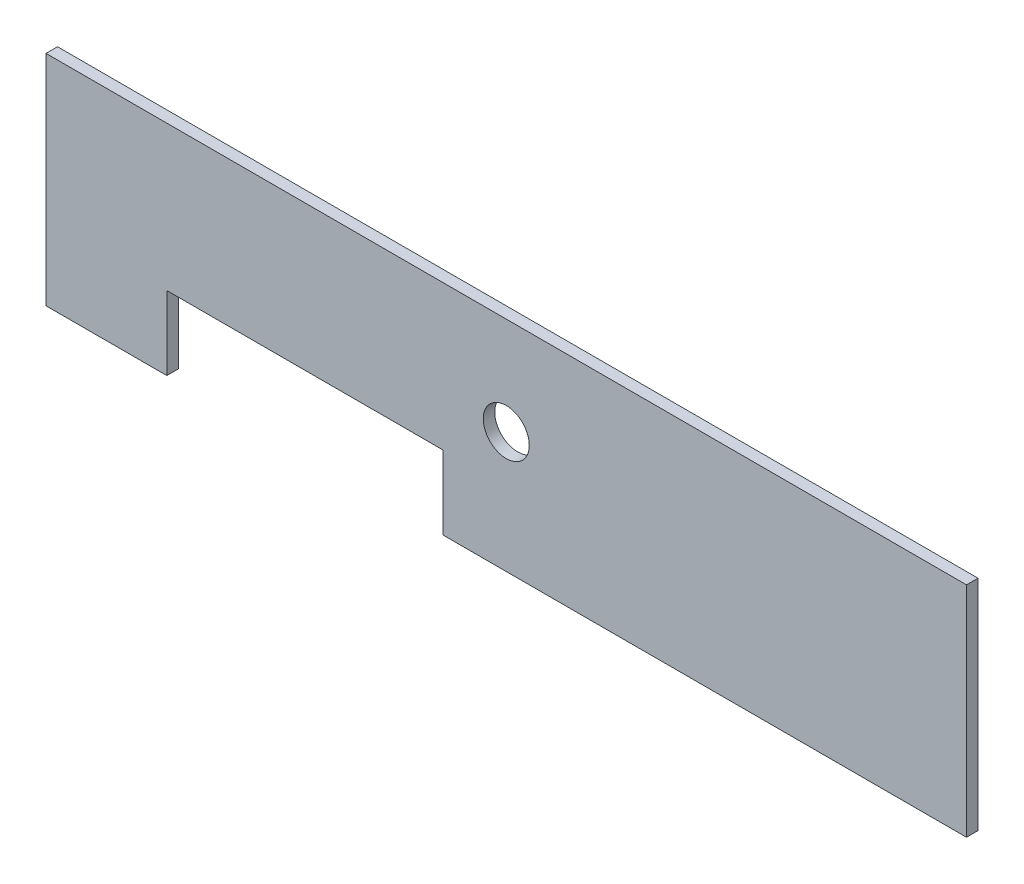
from build123d import *

# Parameters (mm, degrees)
EXTRUDE_1_DEPTH     = 5
SKETCH_2_R          = 10
CUT_EXTRUDE_1_DEPTH = 10


with BuildPart() as part:
    # 草图1 → 凸台-拉伸1 (new body)
    with BuildSketch(Plane.XY):
        Polygon((-255.102040816, 148.567224711), (144.897959184, 148.567224711), (144.897959184, 53.567224711), (92.397959184, 53.567224711), (-27.602040816, 53.567224711), (-82.602040816, 53.567224711), (-82.602040816, 85.567224711), (-202.602040816, 85.567224711), (-202.602040816, 53.567224711), (-255.102040816, 53.567224711), align=None)
    extrude(amount=EXTRUDE_1_DEPTH)

    # 草图2 → 切除-拉伸1 (cut)
    with BuildSketch(Plane.XY.offset(5)):
        with Locations((-55.102040816, 106.067224711)):
            Circle(SKETCH_2_R)
    extrude(amount=-CUT_EXTRUDE_1_DEPTH, mode=Mode.SUBTRACT)


solid = part.part
